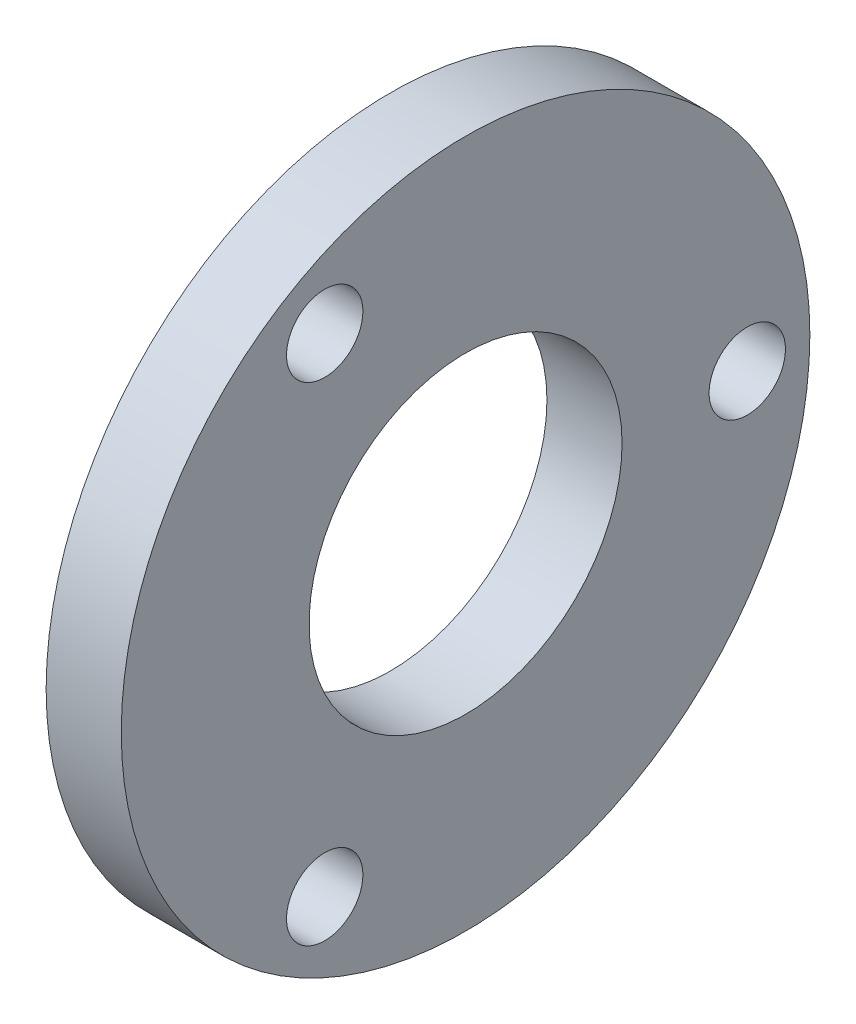
from build123d import *

# Parameters (mm, degrees)
SKETCH_1_R      = 27.5
SKETCH_1_R_2    = 12.5
SKETCH_1_R_3    = 3.05
EXTRUDE_1_DEPTH = 6


with BuildPart() as part:
    # 草图1 → 凸台-拉伸1 (new body)
    with BuildSketch(Plane(origin=(0, 0, 0), x_dir=(0, 0, -1), z_dir=(1, 0, 0))):
        Circle(SKETCH_1_R)
        Circle(SKETCH_1_R_2, mode=Mode.SUBTRACT)
        with Locations((22.5, 0)):
            Circle(SKETCH_1_R_3, mode=Mode.SUBTRACT)
        with Locations((-11.25, -19.485571585)):
            Circle(SKETCH_1_R_3, mode=Mode.SUBTRACT)
        with Locations((-11.25, 19.485571585)):
            Circle(SKETCH_1_R_3, mode=Mode.SUBTRACT)
    extrude(amount=EXTRUDE_1_DEPTH)


solid = part.part
